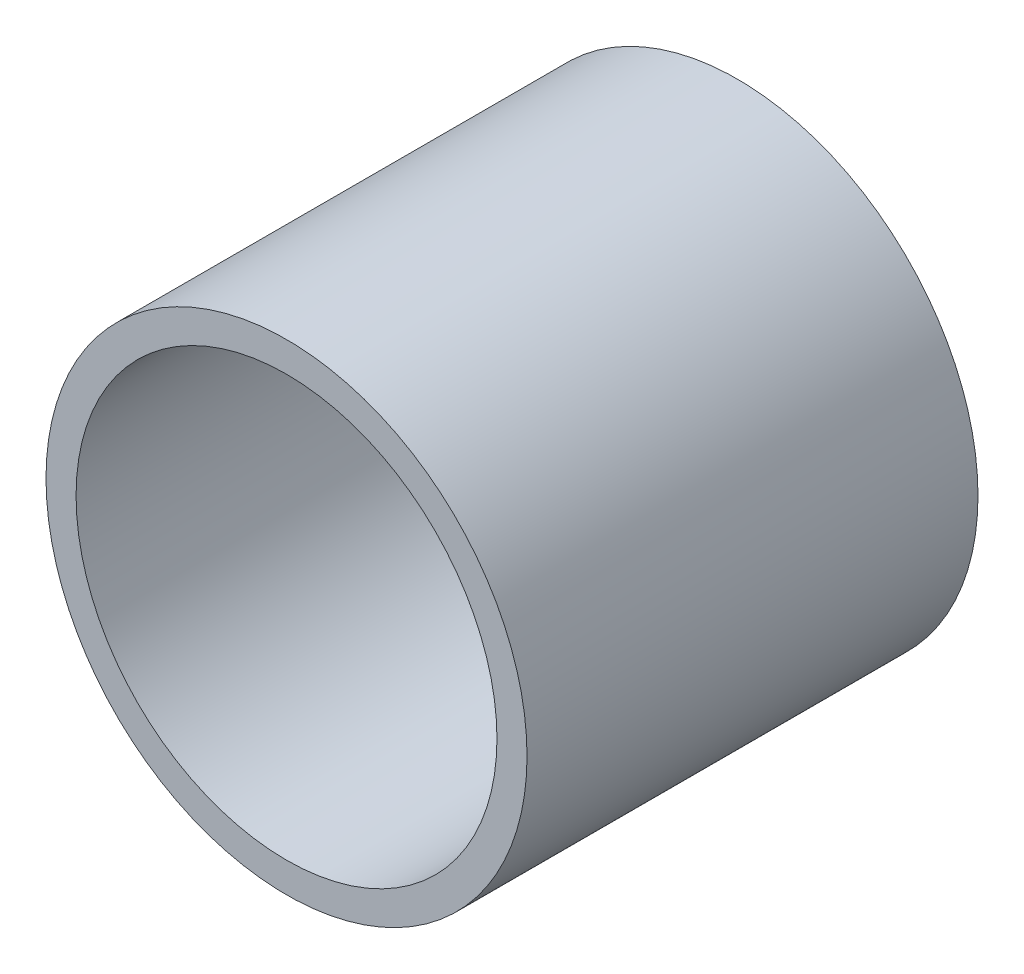
from build123d import *

# Parameters (mm, degrees)
SKETCH2_R           = 24
SKETCH2_R_2         = 21
BOSS_EXTRUDE1_DEPTH = 45


with BuildPart() as part:
    # Sketch2 → Boss-Extrude1 (new body)
    with BuildSketch(Plane.XY):
        with Locations(Location((0, 0, 0), (0, 0, 180))):
            Circle(SKETCH2_R)
        with Locations(Location((0, 0, 0), (0, 0, 180))):
            Circle(SKETCH2_R_2, mode=Mode.SUBTRACT)
    extrude(amount=BOSS_EXTRUDE1_DEPTH)


solid = part.part
